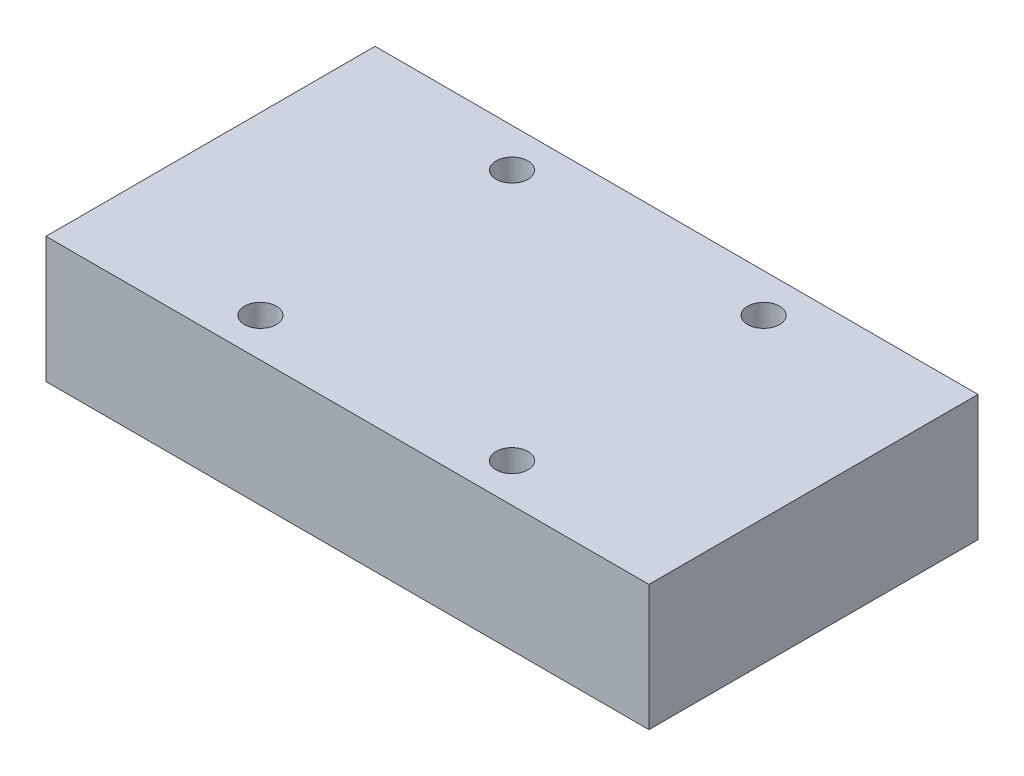
from build123d import *

# Parameters (mm, degrees)
SKETCH_1_W             = 62.3
SKETCH_1_H             = 34
EXTRUDE_281_DEPTH      = 13
HOLE_WIZARD_M4_1_D     = 3.3
HOLE_WIZARD_M4_1_DEPTH = 5
HOLE_WIZARD_M4_1_TIP   = 0.991420021


with BuildPart() as part:
    # 草图1 → Extrude 281 (new body)
    with BuildSketch(Plane(origin=(0, 0, 0), x_dir=(1, 0, 0), z_dir=(0, 1, 0))):
        Rectangle(SKETCH_1_W, SKETCH_1_H)
    extrude(amount=EXTRUDE_281_DEPTH)

    # M4 螺纹孔1
    with Locations(Plane(origin=(0, 13, 0), x_dir=(1, 0, 0), z_dir=(0, 1, 0))):
        with Locations((-13, 13), (-13, -13), (13, 13), (13, -13)):
            Hole(HOLE_WIZARD_M4_1_D / 2, depth=HOLE_WIZARD_M4_1_DEPTH)
            with Locations((0, 0, -(HOLE_WIZARD_M4_1_DEPTH + HOLE_WIZARD_M4_1_TIP / 2))):  # 118° drill point
                Cone(0, HOLE_WIZARD_M4_1_D / 2, HOLE_WIZARD_M4_1_TIP, mode=Mode.SUBTRACT)


solid = part.part
